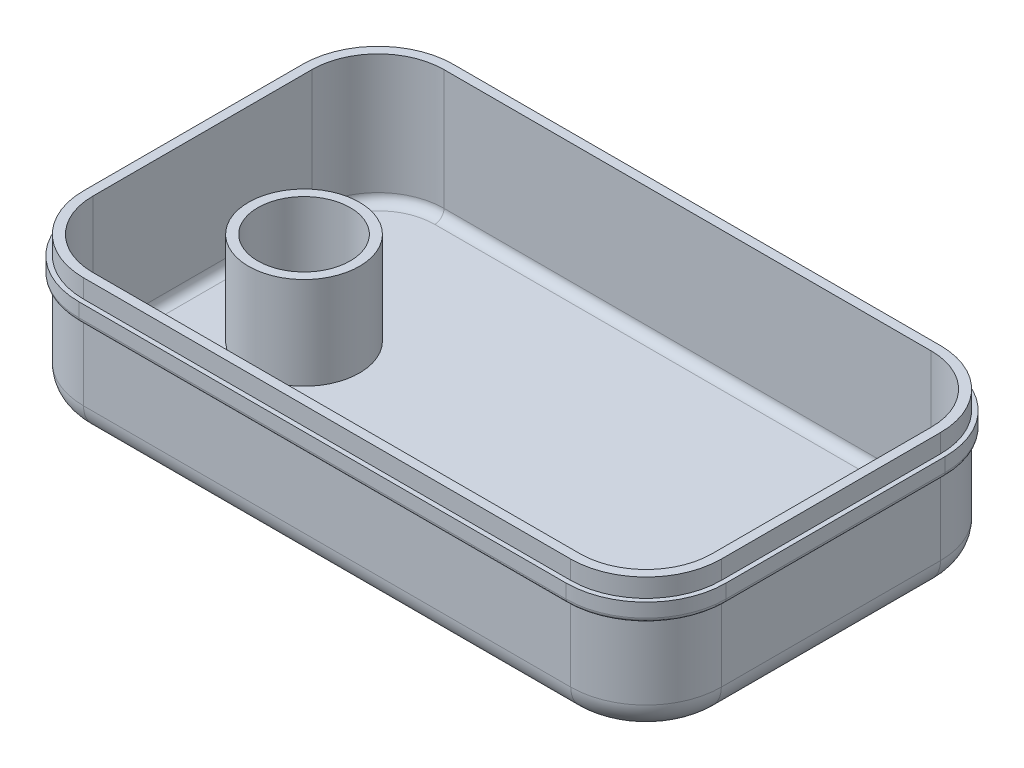
from build123d import *

# Parameters (mm, degrees)
DODANIE_WYCI_GNI_CIE1_DEPTH = 15
SZKIC1_3_R                  = 6
DODANIE_WYCI_GNI_CIE2_DEPTH = 1
SZKIC1_4_R                  = 6
SZKIC1_4_R_2                = 5
DODANIE_WYCI_GNI_CIE3_DEPTH = 11
ZAOKR_GLENIE1_R             = 3
ZAOKR_GLENIE2_R             = 0.5
ZAOKR_GLENIE3_R             = 1


with BuildPart() as part:
    # Szkic1 → Dodanie-wyciągnięcie1 (new body)
    with BuildSketch(Plane(origin=(0, 0, 0), x_dir=(1, 0, 0), z_dir=(0, 1, 0))):
        with BuildLine():
            Line((-26.353622573, 20), (26.353622573, 20))
            ThreePointArc((26.353622573, 20), (32.113981294, 17.613981294), (34.5, 11.853622573))
            Line((34.5, 11.853622573), (34.5, -11.853622573))
            ThreePointArc((34.5, -11.853622573), (32.113981294, -17.613981294), (26.353622573, -20))
            Line((26.353622573, -20), (-26.353622573, -20))
            ThreePointArc((-26.353622573, -20), (-32.113981294, -17.613981294), (-34.5, -11.853622573))
            Line((-34.5, -11.853622573), (-34.5, 11.853622573))
            ThreePointArc((-34.5, 11.853622573), (-32.113981294, 17.613981294), (-26.353622573, 20))
        make_face()
        with BuildLine():
            Line((-26.353622573, 19), (26.353622573, 19))
            ThreePointArc((26.353622573, 19), (31.406874513, 16.906874513), (33.5, 11.853622573))
            Line((33.5, 11.853622573), (33.5, -11.853622573))
            ThreePointArc((33.5, -11.853622573), (31.406874513, -16.906874513), (26.353622573, -19))
            Line((26.353622573, -19), (-26.353622573, -19))
            ThreePointArc((-26.353622573, -19), (-31.406874513, -16.906874513), (-33.5, -11.853622573))
            Line((-33.5, -11.853622573), (-33.5, 11.853622573))
            ThreePointArc((-33.5, 11.853622573), (-31.406874513, 16.906874513), (-26.353622573, 19))
        make_face(mode=Mode.SUBTRACT)
    extrude(amount=DODANIE_WYCI_GNI_CIE1_DEPTH)

    # Szkic1<3> → Dodanie-wyciągnięcie2 (add)
    with BuildSketch(Plane(origin=(0, 0, 0), x_dir=(1, 0, 0), z_dir=(0, 1, 0))):
        with BuildLine():
            Line((26.353622573, 19), (-26.353622573, 19))
            ThreePointArc((-26.353622573, 19), (-31.406874513, 16.906874513), (-33.5, 11.853622573))
            Line((-33.5, 11.853622573), (-33.5, -11.853622573))
            ThreePointArc((-33.5, -11.853622573), (-31.406874513, -16.906874513), (-26.353622573, -19))
            Line((-26.353622573, -19), (26.353622573, -19))
            ThreePointArc((26.353622573, -19), (31.406874513, -16.906874513), (33.5, -11.853622573))
            Line((33.5, -11.853622573), (33.5, 11.853622573))
            ThreePointArc((33.5, 11.853622573), (31.406874513, 16.906874513), (26.353622573, 19))
        make_face()
        with Locations((-22.5, 0)):
            Circle(SZKIC1_3_R, mode=Mode.SUBTRACT)
    extrude(amount=DODANIE_WYCI_GNI_CIE2_DEPTH)

    # Szkic1<4> → Dodanie-wyciągnięcie3 (add)
    with BuildSketch(Plane(origin=(0, 0, 0), x_dir=(1, 0, 0), z_dir=(0, 1, 0))):
        with Locations((-22.5, 0)):
            Circle(SZKIC1_4_R)
        with Locations((-22.5, 0)):
            Circle(SZKIC1_4_R_2, mode=Mode.SUBTRACT)
    extrude(amount=DODANIE_WYCI_GNI_CIE3_DEPTH)

    # Zaokrąglenie1
    zaokr_glenie1_edges = [part.edges().sort_by_distance(p)[0] for p in [
        (-34.5, 0, 0),
        (-32.113981294, 0, -17.613981294),
        (0, 0, -20),
        (32.113981294, 0, -17.613981294),
        (34.5, 0, 0),
        (32.113981294, 0, 17.613981294),
        (-32.113981294, 0, 17.613981294),
        (0, 0, 20),
    ]]
    fillet(zaokr_glenie1_edges, radius=ZAOKR_GLENIE1_R)

    # Wyciągnięcie po ścieżce1: sweep along a path in Szkic2
    with BuildLine(Plane(origin=(0, 13, 0), x_dir=(1, 0, 0), z_dir=(0, 1, 0))) as wyci_gni_cie_po_cie_ce1_path:
        Line((-26.353622573, 20), (26.353622573, 20))
        ThreePointArc((26.353622573, 20), (32.113981294, 17.613981294), (34.5, 11.853622573))
        Line((34.5, 11.853622573), (34.5, -11.853622573))
        ThreePointArc((34.5, -11.853622573), (32.113981294, -17.613981294), (26.353622573, -20))
        Line((26.353622573, -20), (-26.353622573, -20))
        ThreePointArc((-26.353622573, -20), (-32.113981294, -17.613981294), (-34.5, -11.853622573))
        Line((-34.5, -11.853622573), (-34.5, 11.853622573))
        ThreePointArc((-34.5, 11.853622573), (-32.113981294, 17.613981294), (-26.353622573, 20))
    # Szkic3 → Wyciągnięcie po ścieżce1 (sweep)
    with BuildSketch(Plane(origin=(0, 0, 0), x_dir=(0, 0, -1), z_dir=(1, 0, 0))):
        with BuildLine():
            Line((20, 13), (20.5, 13))
            Line((20.5, 13), (20.5, 11.5))
            ThreePointArc((20.5, 11.5), (20.353553391, 11.146446609), (20, 11))
            Line((20, 11), (20, 13))
        make_face()
    sweep(path=wyci_gni_cie_po_cie_ce1_path.line)

    # Zaokrąglenie2
    zaokr_glenie2_edges = [part.edges().sort_by_distance(p)[0] for p in [
        (-27.5, 0, 0),
    ]]
    fillet(zaokr_glenie2_edges, radius=ZAOKR_GLENIE2_R)

    # Zaokrąglenie3
    zaokr_glenie3_edges = [part.edges().sort_by_distance(p)[0] for p in [
        (-31.406874513, 1, 16.906874513),
        (-33.5, 1, 0),
        (-31.406874513, 1, -16.906874513),
        (0, 1, -19),
        (31.406874513, 1, -16.906874513),
        (33.5, 1, 0),
        (31.406874513, 1, 16.906874513),
        (0, 1, 19),
    ]]
    fillet(zaokr_glenie3_edges, radius=ZAOKR_GLENIE3_R)


solid = part.part
